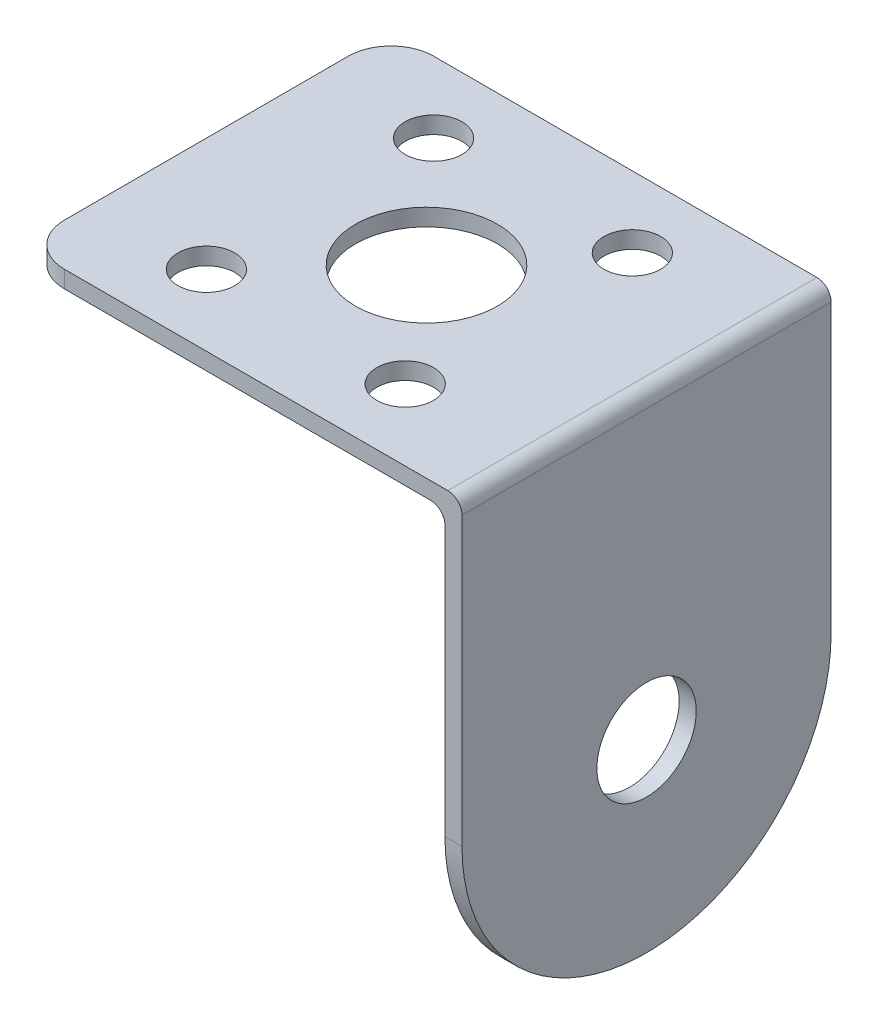
from build123d import *

# Parameters (mm, degrees)
SKETCH1_W           = 31
SKETCH1_H           = 26
BOSS_EXTRUDE1_DEPTH = 1.2
SKETCH3_W           = 1.2
SKETCH3_H           = 26
BOSS_EXTRUDE2_DEPTH = 33
SKETCH4_R           = 3.5
CUT_EXTRUDE1_DEPTH  = 1.2
SKETCH2_R           = 5
SKETCH2_R_2         = 2
CUT_EXTRUDE2_DEPTH  = 1.2
FILLET1_R           = 1
FILLET2_R           = 3


with BuildPart() as part:
    # Sketch1 → Boss-Extrude1 (new body)
    with BuildSketch(Plane(origin=(0, 0, 0), x_dir=(1, 0, 0), z_dir=(0, 1, 0))):
        Rectangle(SKETCH1_W, SKETCH1_H)
    extrude(amount=BOSS_EXTRUDE1_DEPTH)

    # Sketch3 → Boss-Extrude2 (add)
    with BuildSketch(Plane.XZ):
        with Locations((14.9, 0)):
            Rectangle(SKETCH3_W, SKETCH3_H)
    extrude(amount=BOSS_EXTRUDE2_DEPTH)

    # Sketch4 → Cut-Extrude1 (cut)
    with BuildSketch(Plane(origin=(15.5, 0, 0), x_dir=(0, 0, -1), z_dir=(1, 0, 0))):
        with BuildLine():
            Line((13, -33), (13, -20))
            ThreePointArc((13, -20), (9.192388155, -29.192388155), (0, -33))
            Line((0, -33), (13, -33))
        make_face()
        with BuildLine():
            Line((-13, -33), (0, -33))
            ThreePointArc((0, -33), (-9.192388155, -29.192388155), (-13, -20))
            Line((-13, -20), (-13, -33))
        make_face()
        with Locations((0, -20)):
            Circle(SKETCH4_R)
    extrude(amount=-CUT_EXTRUDE1_DEPTH, mode=Mode.SUBTRACT)

    # Sketch2 → Cut-Extrude2 (cut)
    with BuildSketch(Plane(origin=(0, 1.2, 0), x_dir=(1, 0, 0), z_dir=(0, 1, 0))):
        with Locations(Location((0, 0, 0), (0, 0, 270))):
            Circle(SKETCH2_R)
        with Locations(Location((-7.5, 8, 0), (0, 0, 270))):
            Circle(SKETCH2_R_2)
        with Locations(Location((6.5, 8, 0), (0, 0, 270))):
            Circle(SKETCH2_R_2)
        with Locations(Location((6.5, -8, 0), (0, 0, 90))):
            Circle(SKETCH2_R_2)
        with Locations(Location((-7.5, -8, 0), (0, 0, 90))):
            Circle(SKETCH2_R_2)
    extrude(amount=-CUT_EXTRUDE2_DEPTH, mode=Mode.SUBTRACT)

    # Fillet1
    fillet1_edges = [part.edges().sort_by_distance(p)[0] for p in [
        (15.5, 1.2, 0),
        (14.3, 0, 0),
    ]]
    fillet(fillet1_edges, radius=FILLET1_R)

    # Fillet2
    fillet2_edges = [part.edges().sort_by_distance(p)[0] for p in [
        (-15.5, 0.6, -13),
        (-15.5, 0.6, 13),
    ]]
    fillet(fillet2_edges, radius=FILLET2_R)


solid = part.part
